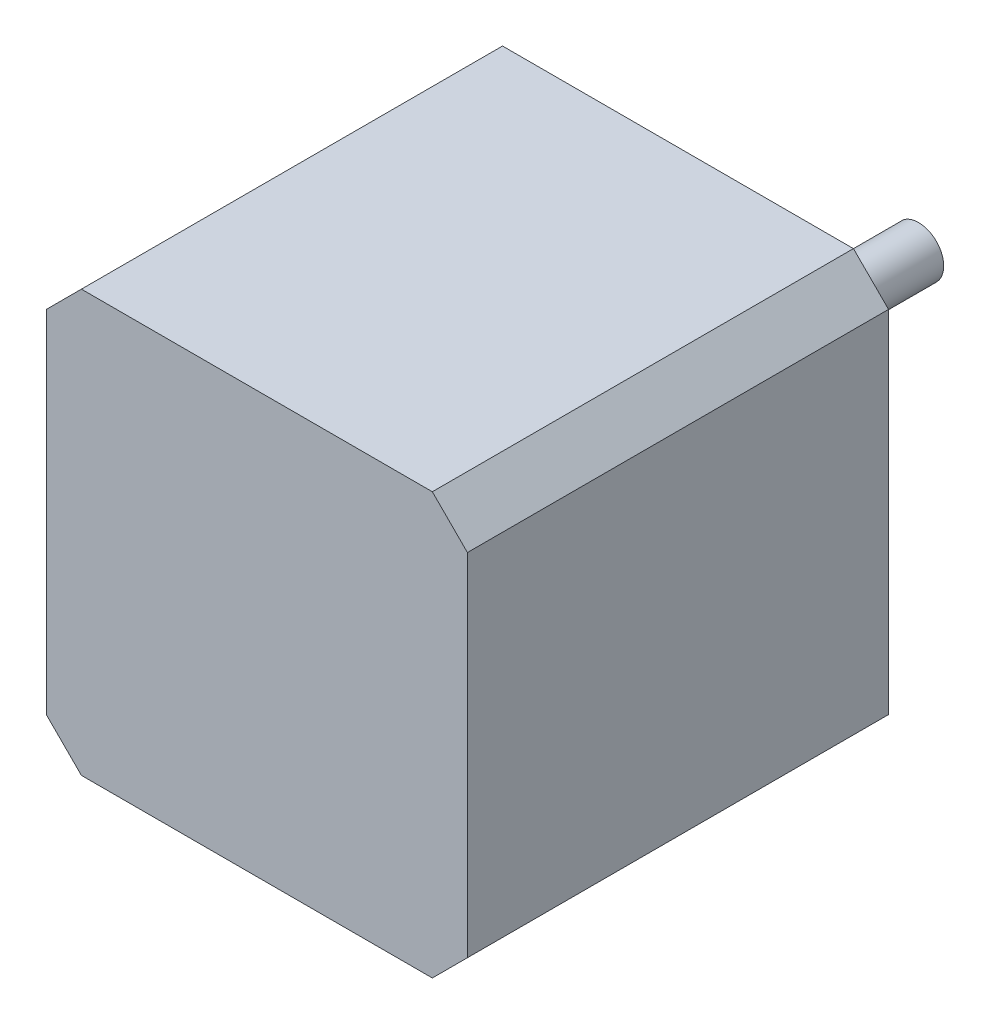
from build123d import *

# Parameters (mm, degrees)
SALIENTE_EXTRUIR1_DEPTH = 42
CROQUIS2_R              = 11
CROQUIS2_R_2            = 5
SALIENTE_EXTRUIR3_DEPTH = 3
SALIENTE_EXTRUIR4_DEPTH = 24
CROQUIS7_R              = 1.25
CORTAR_EXTRUIR2_DEPTH   = 15


with BuildPart() as part:
    # Croquis1 → Saliente-Extruir1 (new body)
    with BuildSketch(Plane.XY):
        Polygon((-17.5, -21), (17.5, -21), (21, -17.5), (21, 17.5), (17.5, 21), (-17.5, 21), (-21, 17.5), (-21, -17.5), align=None)
    extrude(amount=SALIENTE_EXTRUIR1_DEPTH)

    # Croquis2 → Saliente-Extruir3 (add)
    with BuildSketch(Plane(origin=(0, 0, 0), x_dir=(-1, 0, 0), z_dir=(0, 0, -1))):
        with Locations(Location((0, 0, 0), (0, 0, 180))):
            Circle(CROQUIS2_R)
        Circle(CROQUIS2_R_2, mode=Mode.SUBTRACT)
    extrude(amount=SALIENTE_EXTRUIR3_DEPTH)

    # Croquis3 → Saliente-Extruir4 (add)
    with BuildSketch(Plane(origin=(0, 0, 0), x_dir=(-1, 0, 0), z_dir=(0, 0, -1))):
        with BuildLine():
            Line((1.5, 0), (-2.5, 0))
            ThreePointArc((-2.5, 0), (-1.118033989, -2.236067977), (1.5, -2))
            Line((1.5, -2), (1.5, 0))
        make_face()
        with BuildLine():
            ThreePointArc((1.5, 2), (-1.118033989, 2.236067977), (-2.5, 0))
            Line((-2.5, 0), (1.5, 0))
            Line((1.5, 0), (1.5, 2))
        make_face()
    extrude(amount=SALIENTE_EXTRUIR4_DEPTH)

    # Croquis7 → Cortar-Extruir2 (cut)
    with BuildSketch(Plane(origin=(0, 0, 0), x_dir=(-1, 0, 0), z_dir=(0, 0, -1))):
        with Locations((-15.909902577, 15.909902577)):
            Circle(CROQUIS7_R)
        with Locations((-15.909902577, -15.909902577)):
            Circle(CROQUIS7_R)
        with Locations((15.909902577, -15.909902577)):
            Circle(CROQUIS7_R)
        with Locations((15.909902577, 15.909902577)):
            Circle(CROQUIS7_R)
    extrude(amount=-CORTAR_EXTRUIR2_DEPTH, mode=Mode.SUBTRACT)


solid = part.part
